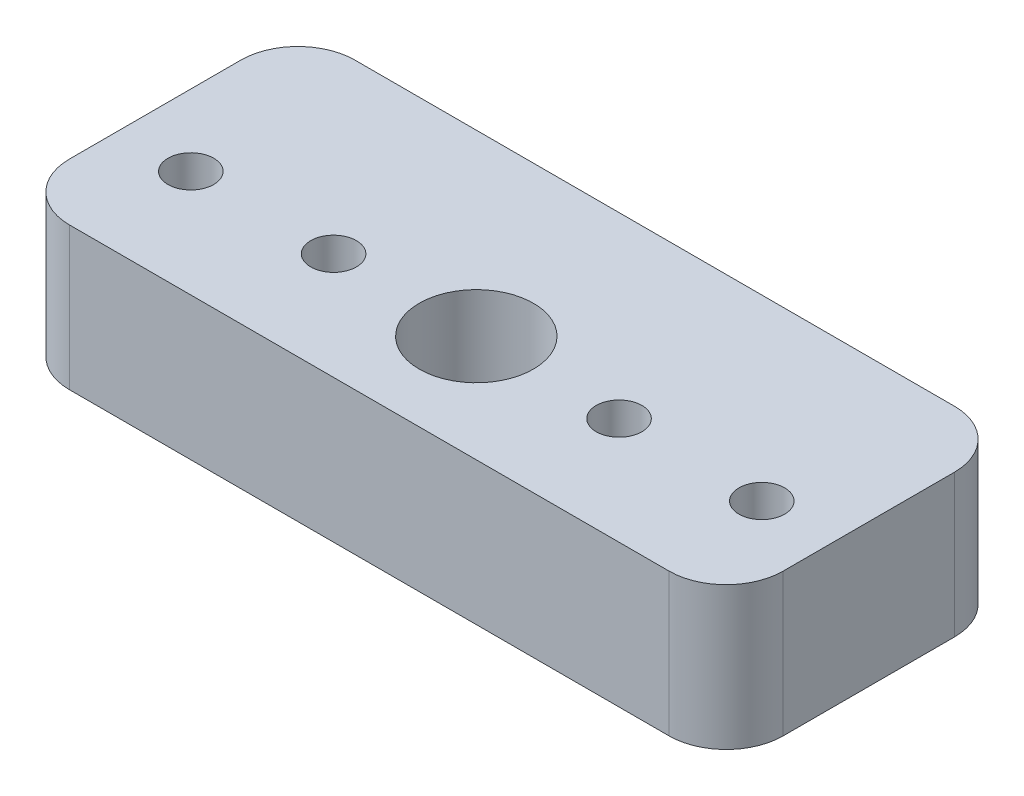
from build123d import *

# Parameters (mm, degrees)
SKETCH1_R           = 4
SKETCH1_R_2         = 1.6
BOSS_EXTRUDE1_DEPTH = 10


with BuildPart() as part:
    # Sketch1 → Boss-Extrude1 (new body)
    with BuildSketch(Plane(origin=(0, 0, 0), x_dir=(1, 0, 0), z_dir=(0, 1, 0))):
        with BuildLine():
            Line((-21, 10), (21, 10))
            ThreePointArc((21, 10), (23.828427125, 8.828427125), (25, 6))
            Line((25, 6), (25, -6))
            ThreePointArc((25, -6), (23.828427125, -8.828427125), (21, -10))
            Line((21, -10), (-21, -10))
            ThreePointArc((-21, -10), (-23.828427125, -8.828427125), (-25, -6))
            Line((-25, -6), (-25, 6))
            ThreePointArc((-25, 6), (-23.828427125, 8.828427125), (-21, 10))
        make_face()
        with Locations(Location((0, -2.5, 0), (0, 0, 270))):
            Circle(SKETCH1_R, mode=Mode.SUBTRACT)
        with Locations(Location((10, -2.5, 0), (0, 0, 270))):
            Circle(SKETCH1_R_2, mode=Mode.SUBTRACT)
        with Locations(Location((20, -2.5, 0), (0, 0, 270))):
            Circle(SKETCH1_R_2, mode=Mode.SUBTRACT)
        with Locations(Location((-20, -2.5, 0), (0, 0, 90))):
            Circle(SKETCH1_R_2, mode=Mode.SUBTRACT)
        with Locations(Location((-10, -2.5, 0), (0, 0, 90))):
            Circle(SKETCH1_R_2, mode=Mode.SUBTRACT)
    extrude(amount=BOSS_EXTRUDE1_DEPTH)


solid = part.part
